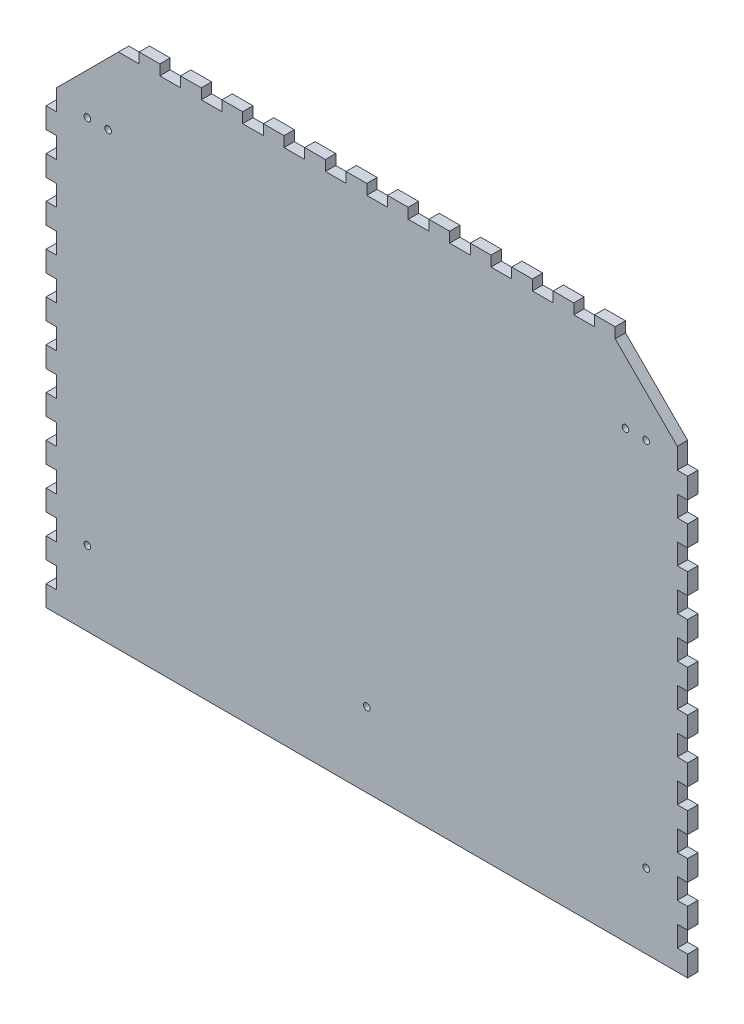
from build123d import *

# Parameters (mm, degrees)
SKIZZE1_R                       = 1.6
AUFSATZ_LINEAR_AUSTRAGEN1_DEPTH = 5


with BuildPart() as part:
    # Skizze1 → Aufsatz-Linear austragen1 (new body)
    with BuildSketch(Plane.XY):
        Polygon((5, 10), (5, 20), (0, 20), (0, 30), (5, 30), (5, 40), (0, 40), (0, 50), (5, 50), (5, 60), (0, 60), (0, 70), (5, 70), (5, 80), (0, 80), (0, 90), (5, 90), (5, 100), (0, 100), (0, 110), (5, 110), (5, 120), (0, 120), (0, 130), (5, 130), (5, 140), (0, 140), (0, 150), (5, 150), (5, 160), (0, 160), (0, 170), (5, 170), (5, 180), (0, 180), (0, 190), (5, 190), (5, 200), (0, 200), (0, 210), (5, 210), (5, 220), (35, 250), (45, 250), (45, 255), (55, 255), (55, 250), (65, 250), (65, 255), (75, 255), (75, 250), (85, 250), (85, 255), (95, 255), (95, 250), (105, 250), (105, 255), (115, 255), (115, 250), (125, 250), (125, 255), (135, 255), (135, 250), (145, 250), (145, 255), (155, 255), (155, 250), (165, 250), (165, 255), (175, 255), (175, 250), (185, 250), (185, 255), (195, 255), (195, 250), (205, 250), (205, 255), (215, 255), (215, 250), (225, 250), (225, 255), (235, 255), (235, 250), (245, 250), (245, 255), (255, 255), (255, 250), (265, 250), (265, 255), (275, 255), (275, 250), (305, 220), (305, 210), (310, 210), (310, 200), (305, 200), (305, 190), (310, 190), (310, 180), (305, 180), (305, 170), (310, 170), (310, 160), (305, 160), (305, 150), (310, 150), (310, 140), (305, 140), (305, 130), (310, 130), (310, 120), (305, 120), (305, 110), (310, 110), (310, 100), (305, 100), (305, 90), (310, 90), (310, 80), (305, 80), (305, 70), (310, 70), (310, 60), (305, 60), (305, 50), (310, 50), (310, 40), (305, 40), (305, 30), (310, 30), (310, 20), (305, 20), (305, 10), (310, 10), (310, 0), (305, 0), (5, 0), (0, 0), (0, 10), align=None)
        with Locations((20, 215)):
            Circle(SKIZZE1_R, mode=Mode.SUBTRACT)
        with Locations((30, 215)):
            Circle(SKIZZE1_R, mode=Mode.SUBTRACT)
        with Locations((290, 215)):
            Circle(SKIZZE1_R, mode=Mode.SUBTRACT)
        with Locations((280, 215)):
            Circle(SKIZZE1_R, mode=Mode.SUBTRACT)
        with Locations((20, 36)):
            Circle(SKIZZE1_R, mode=Mode.SUBTRACT)
        with Locations((155, 36)):
            Circle(SKIZZE1_R, mode=Mode.SUBTRACT)
        with Locations((290, 36)):
            Circle(SKIZZE1_R, mode=Mode.SUBTRACT)
    extrude(amount=AUFSATZ_LINEAR_AUSTRAGEN1_DEPTH)


solid = part.part
